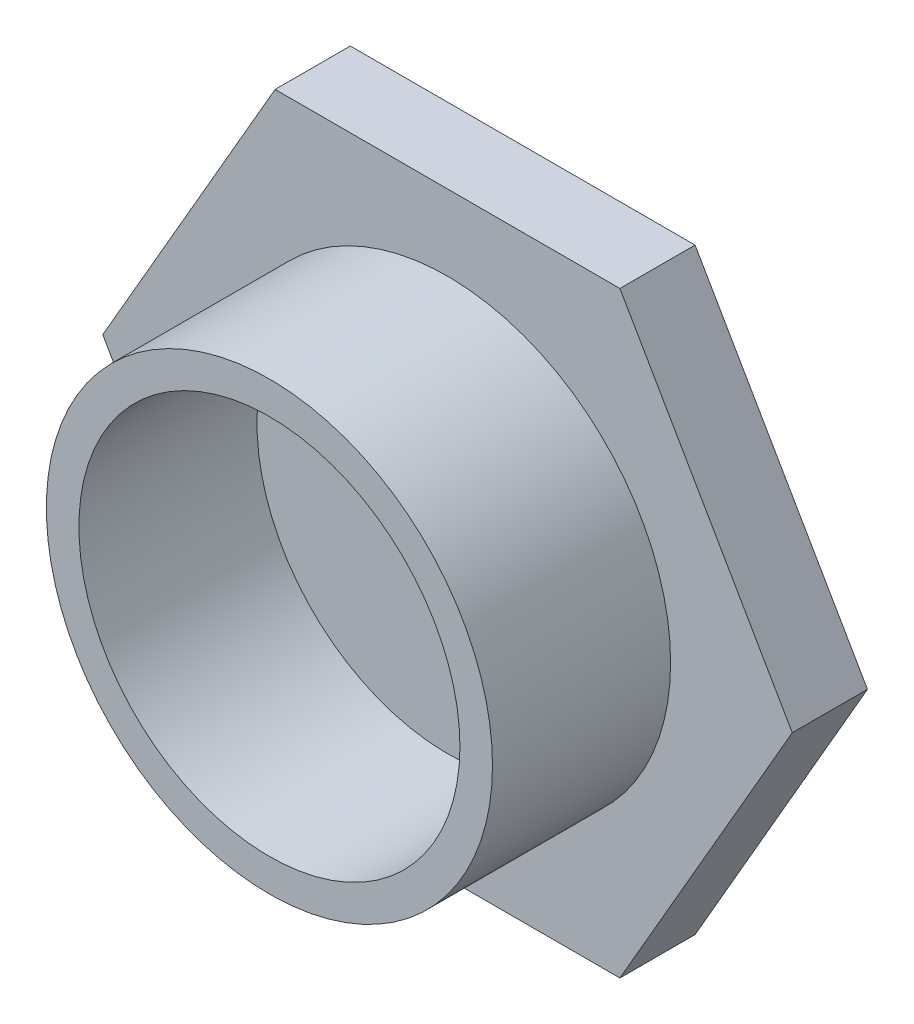
from build123d import *

# Parameters (mm, degrees)
BOSS_EXTRUDE1_DEPTH = 5.4356
BOSS_EXTRUDE2_START = 5.4356
SKETCH1_3_R         = 16.129916362
SKETCH1_3_R_2       = 13.776067448
BOSS_EXTRUDE2_DEPTH = 12.8778


with BuildPart() as part:
    # Sketch1 → Boss-Extrude1 (new body)
    with BuildSketch(Plane.XY):
        Polygon((12.464992312, 21.59), (-12.464992312, 21.59), (-24.929984624, 0), (-12.464992312, -21.59), (12.464992312, -21.59), (24.929984624, 0), align=None)
    extrude(amount=BOSS_EXTRUDE1_DEPTH)

    # Sketch1<3> → Boss-Extrude2 (add)
    with BuildSketch(Plane.XY.offset(BOSS_EXTRUDE2_START)):
        Circle(SKETCH1_3_R)
        Circle(SKETCH1_3_R_2, mode=Mode.SUBTRACT)
    extrude(amount=BOSS_EXTRUDE2_DEPTH)


solid = part.part
